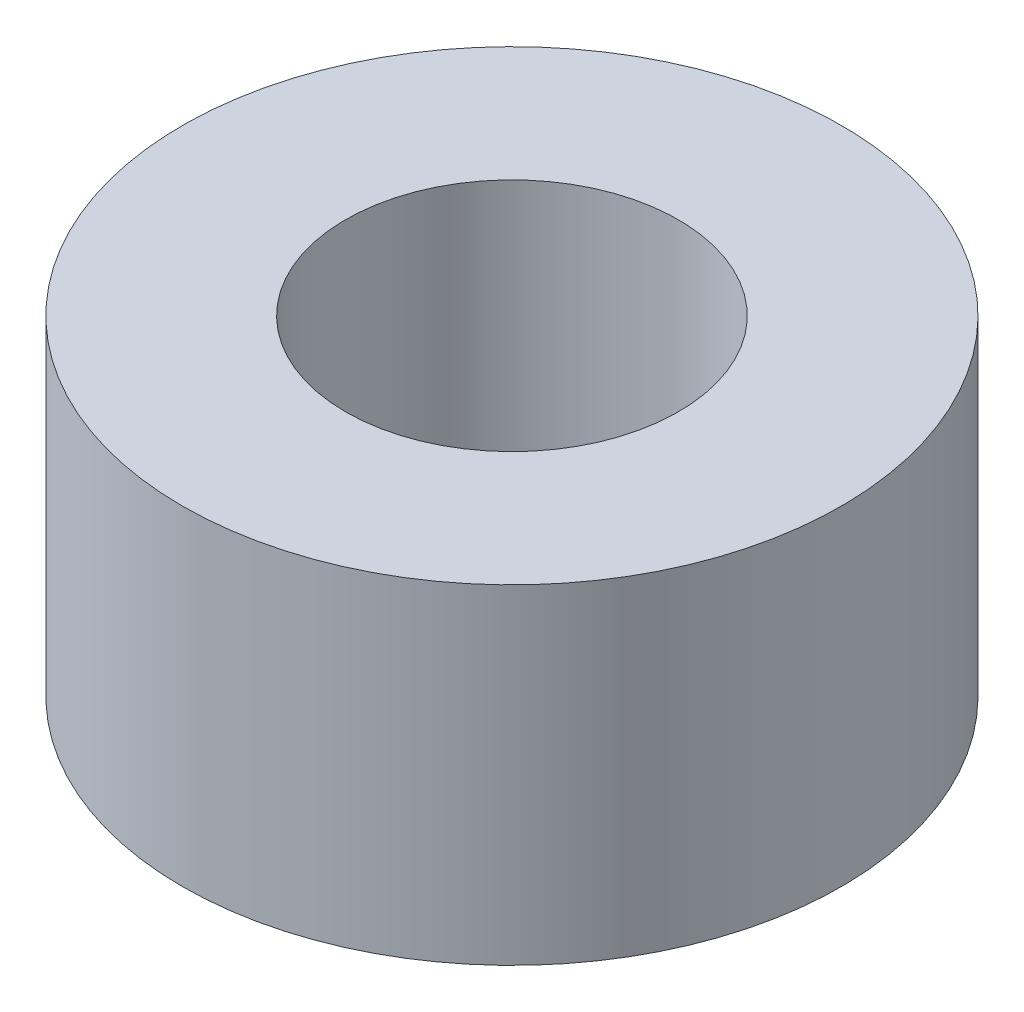
from build123d import *

# Parameters (mm, degrees)
SKETCH_1_R      = 5
SKETCH_1_R_2    = 2.525
EXTRUDE_1_DEPTH = 2.5


with BuildPart() as part:
    # ｽｹｯﾁ1 → ﾎﾞｽ - 押し出し1 (new, symmetric)
    with BuildSketch(Plane(origin=(0, 0, 0), x_dir=(1, 0, 0), z_dir=(0, 1, 0))):
        with Locations(Location((0, 0, 0), (0, 0, 270))):
            Circle(SKETCH_1_R)
        with Locations(Location((0, 0, 0), (0, 0, 270))):
            Circle(SKETCH_1_R_2, mode=Mode.SUBTRACT)
    extrude(amount=EXTRUDE_1_DEPTH, both=True)


solid = part.part
